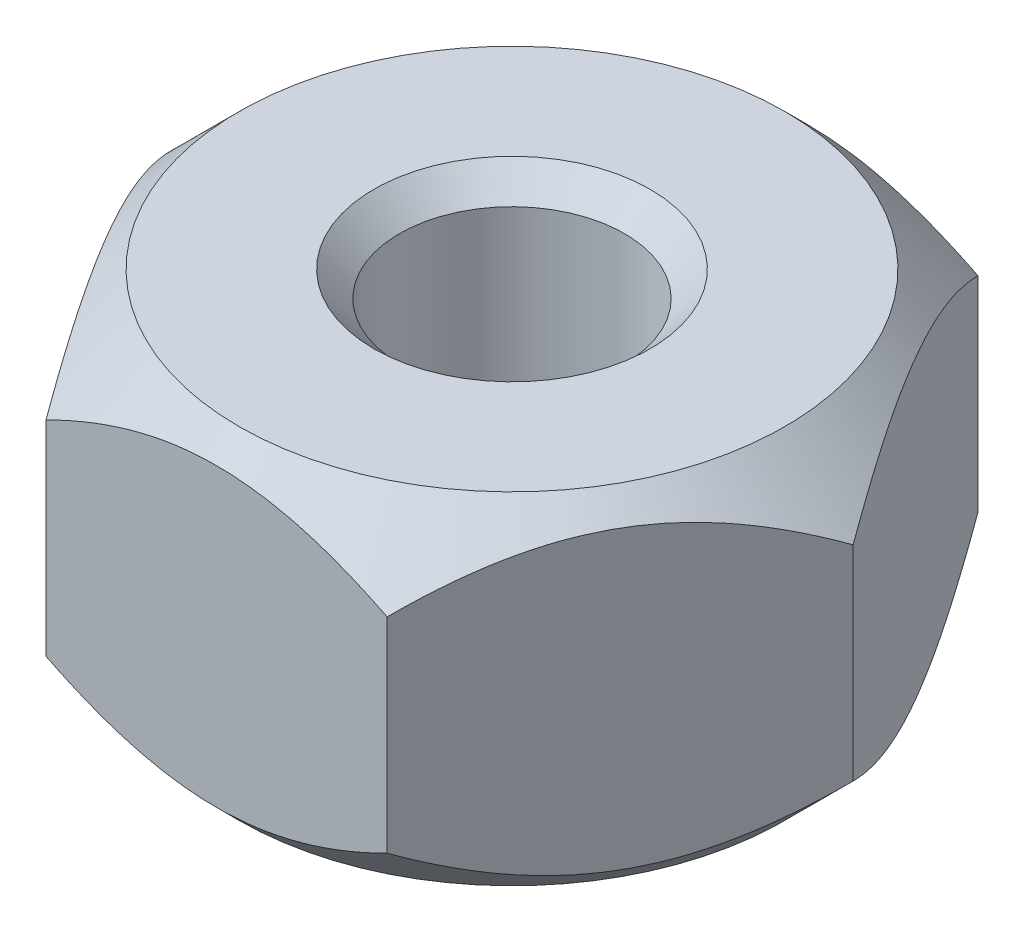
from build123d import *

# Parameters (mm, degrees)
BOSS_EXTRUDE1_DEPTH             = 2.5
M4X0_7_TAPPED_HOLE1_D           = 3.3
M4X0_7_TAPPED_HOLE1_DEPTH       = 9.108579979
M4X0_7_TAPPED_HOLE1_CSINK_D     = 4.05
M4X0_7_TAPPED_HOLE1_CSINK_ANGLE = 90
M4X0_7_TAPPED_HOLE1_TIP         = 0.991420021


with BuildPart() as part:
    # Sketch1 → Boss-Extrude1 (new, symmetric)
    with BuildSketch(Plane(origin=(0, 0, 0), x_dir=(1, 0, 0), z_dir=(0, 1, 0))):
        Polygon((2.5, -4.330127019), (5, 0), (2.5, 4.330127019), (-2.5, 4.330127019), (-5, 0), (-2.5, -4.330127019), align=None)
    extrude(amount=BOSS_EXTRUDE1_DEPTH, both=True)

    # Sketch2 → Cut-Revolve1 (revolve, cut)
    with BuildSketch(Plane.XY, mode=Mode.PRIVATE) as cut_revolve1_sk:
        Polygon((4, 2.5), (5, 1.5), (5, 2.5), align=None)
    cut_revolve1 = revolve(cut_revolve1_sk.sketch.rotate(Axis((0, 0, 0), (0, 1, 0)), 90), axis=Axis((0, 0, 0), (0, 1, 0)), mode=Mode.SUBTRACT)

    # Mirror1: Cut-Revolve1 across plane
    add(cut_revolve1.mirror(Plane.ZX), mode=Mode.SUBTRACT)

    # M4x0.7 Tapped Hole1
    with Locations(Plane(origin=(0, 2.5, 0), x_dir=(1, 0, 0), z_dir=(0, 1, 0))):
        with Locations((0, 0)):
            CounterSinkHole(M4X0_7_TAPPED_HOLE1_D / 2, M4X0_7_TAPPED_HOLE1_CSINK_D / 2, depth=M4X0_7_TAPPED_HOLE1_DEPTH, counter_sink_angle=M4X0_7_TAPPED_HOLE1_CSINK_ANGLE)
            with Locations((0, 0, -(M4X0_7_TAPPED_HOLE1_DEPTH + M4X0_7_TAPPED_HOLE1_TIP / 2))):  # 118° drill point
                Cone(0, M4X0_7_TAPPED_HOLE1_D / 2, M4X0_7_TAPPED_HOLE1_TIP, mode=Mode.SUBTRACT)


solid = part.part
